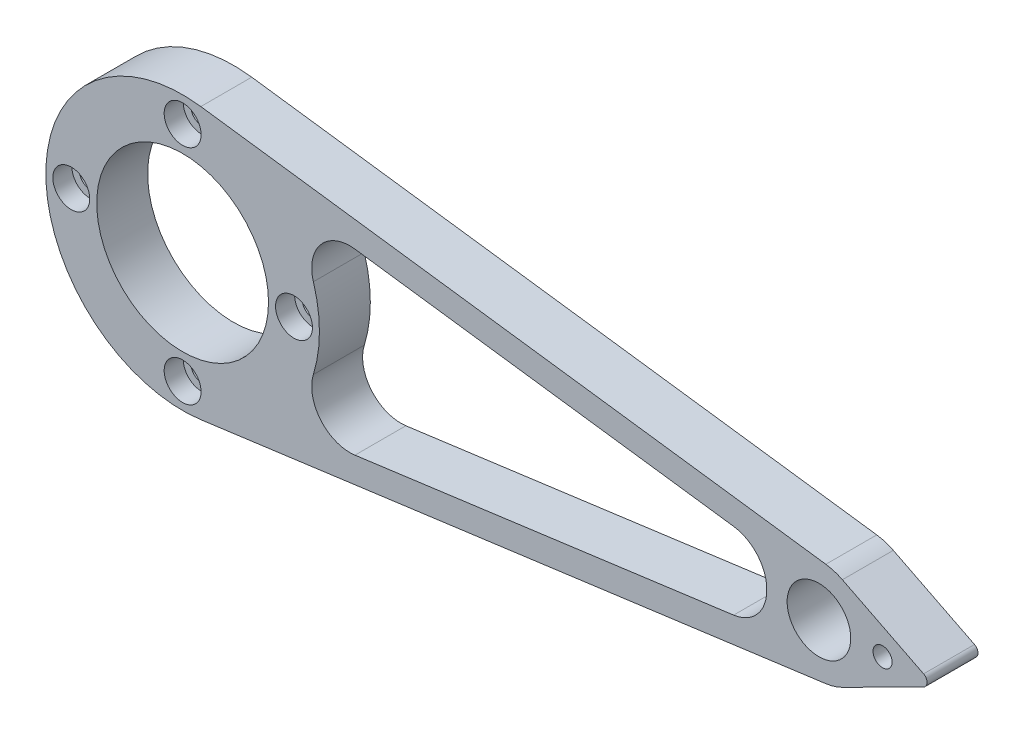
from build123d import *

# Parameters (mm, degrees)
ESQUISSE1_R             = 21.5
ESQUISSE1_R_2           = 1.7
ESQUISSE1_R_3           = 13.5
BOSS_EXTRU_1_DEPTH      = 8
BOSS_EXTRU_2_START      = -8
ESQUISSE2_R             = 5
BOSS_EXTRU_2_DEPTH      = 8
ENL_V_MAT_EXTRU_1_DEPTH = 111.605108381
CONG_1_R                = 6
ESQUISSE4_R             = 1.5
BOSS_EXTRU_3_DEPTH      = 8
ESQUISSE5_R             = 2.9
ENL_V_MAT_EXTRU_2_DEPTH = 3


with BuildPart() as part:
    # Esquisse1 → Boss.-Extru.1 (new body)
    with BuildSketch(Plane.XY):
        Circle(ESQUISSE1_R)
        with Locations((0, 17.5)):
            Circle(ESQUISSE1_R_2, mode=Mode.SUBTRACT)
        with Locations((17.5, 0)):
            Circle(ESQUISSE1_R_2, mode=Mode.SUBTRACT)
        with Locations((0, -17.5)):
            Circle(ESQUISSE1_R_2, mode=Mode.SUBTRACT)
        with Locations((-17.5, 0)):
            Circle(ESQUISSE1_R_2, mode=Mode.SUBTRACT)
        Circle(ESQUISSE1_R_3, mode=Mode.SUBTRACT)
    extrude(amount=BOSS_EXTRU_1_DEPTH)

    # Esquisse2 → Boss.-Extru.2 (add)
    with BuildSketch(Plane.XY.offset(8).offset(BOSS_EXTRU_2_START)):
        with BuildLine():
            Line((2.8595, 21.308994809), (101.0906, 8.127151508))
            ThreePointArc((101.0906, 8.127151508), (108.2, 0), (101.0906, -8.127151508))
            Line((101.0906, -8.127151508), (2.8595, -21.308994809))
            ThreePointArc((2.8595, -21.308994809), (21.5, 0), (2.8595, 21.308994809))
        make_face()
        with Locations((100, 0)):
            Circle(ESQUISSE2_R, mode=Mode.SUBTRACT)
    extrude(amount=BOSS_EXTRU_2_DEPTH)

    # Esquisse3 → Enlèv. mat.-Extru.1 (cut, through all)
    with BuildSketch(Plane.XY.offset(8)):
        with BuildLine():
            Line((14.706535342, 15.683361191), (93.578440575, 5.099370015))
            ThreePointArc((93.578440575, 5.099370015), (91.8, 0), (93.578440575, -5.099370015))
            Line((93.578440575, -5.099370015), (14.706535342, -15.683361191))
            ThreePointArc((14.706535342, -15.683361191), (21.5, 0), (14.706535342, 15.683361191))
        make_face()
    extrude(amount=-ENL_V_MAT_EXTRU_1_DEPTH, mode=Mode.SUBTRACT)

    # Congé1
    cong_1_edges = [part.edges().sort_by_distance(p)[0] for p in [
        (14.706535342, -15.683361191, 4),
        (14.706535342, 15.683361191, 4),
        (93.578440575, 5.099370015, 4),
        (93.578440575, -5.099370015, 4),
    ]]
    fillet(cong_1_edges, radius=CONG_1_R)

    # Esquisse4 → Boss.-Extru.3 (add)
    with BuildSketch(Plane.XY.offset(8)):
        with BuildLine():
            Line((103.69, 7.322834151), (116.45, 0.893028555))
            ThreePointArc((116.45, 0.893028555), (117, 0), (116.45, -0.893028555))
            Line((116.45, -0.893028555), (103.69, -7.322834151))
            ThreePointArc((103.69, -7.322834151), (108.2, 0), (103.69, 7.322834151))
        make_face()
        with Locations((110, 0)):
            Circle(ESQUISSE4_R, mode=Mode.SUBTRACT)
    extrude(amount=-BOSS_EXTRU_3_DEPTH)

    # Esquisse5 → Enlèv. mat.-Extru.2 (cut)
    with BuildSketch(Plane.XY.offset(8)):
        with Locations((0, 17.5)):
            Circle(ESQUISSE5_R)
        with Locations((17.5, 0)):
            Circle(ESQUISSE5_R)
        with Locations((0, -17.5)):
            Circle(ESQUISSE5_R)
        with Locations((-17.5, 0)):
            Circle(ESQUISSE5_R)
    extrude(amount=-ENL_V_MAT_EXTRU_2_DEPTH, mode=Mode.SUBTRACT)


solid = part.part
